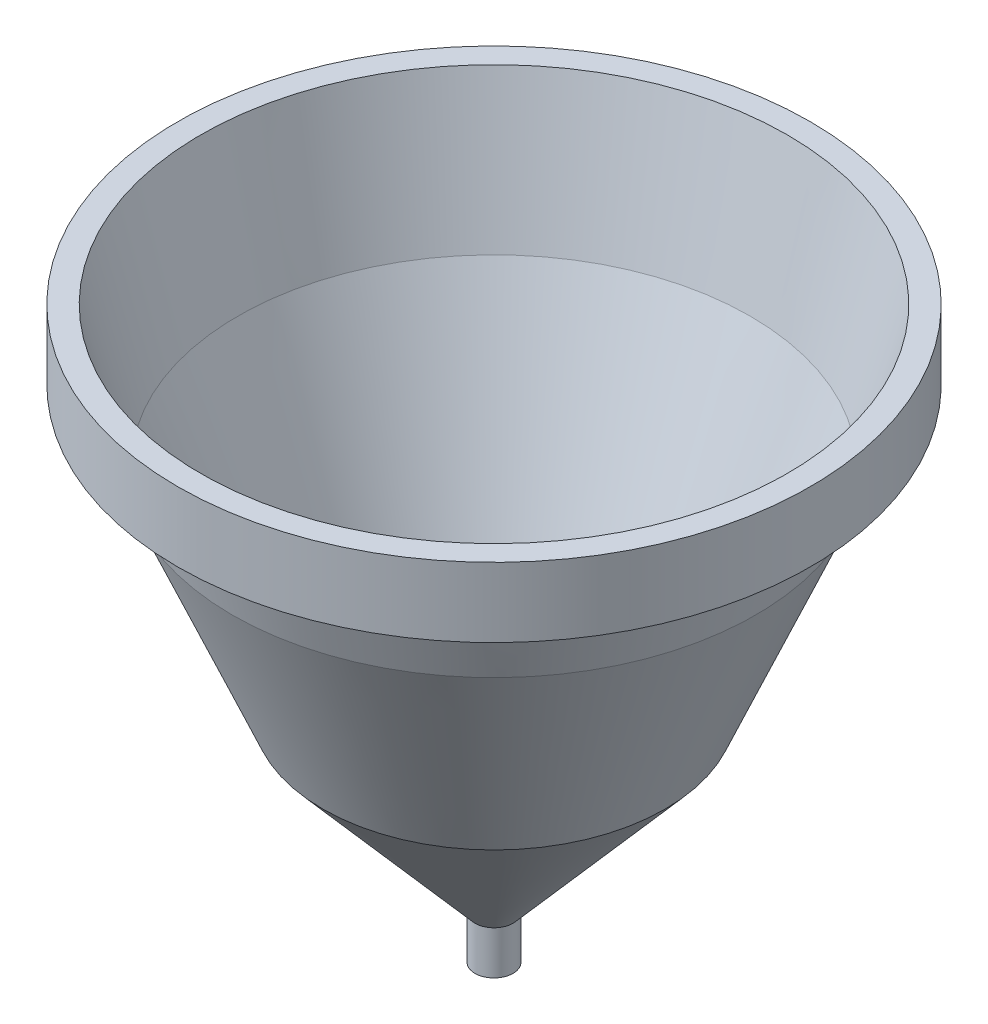
from build123d import *


with BuildPart() as part:
    # Schizzo1 → Rivoluzione1 (revolve)
    with BuildSketch(Plane(origin=(0, 0, 0), x_dir=(0, 0, -1), z_dir=(1, 0, 0)), mode=Mode.PRIVATE) as rivoluzione1_sk:
        Polygon((24.193102917, 11.737734445), (24.193102917, -3.262265555), (25.77022715, -3.392816036), (25.77022715, 12.407183964), (-26.71449517, 72.783950382), (-28.291619402, 72.114500863), align=None)
        Polygon((-59.550109681, 145.754889139), (-28.291619402, 72.114500863), (-26.71449517, 72.783950382), (-57.688820987, 145.754889139), (-66.872170267, 180.027615233), (-70.49877626, 193.562293059), (-78.40877626, 193.562293059), (-78.40877626, 169.562293059), (-76.60877626, 169.562293059), (-76.60877626, 179.562293059), (-68.60877626, 179.562293059), align=None)
    revolve(rivoluzione1_sk.sketch.rotate(Axis((0, -3.392816036, -30.77022715), (0, 1, 0)), 180), axis=Axis((0, -3.392816036, -30.77022715), (0, 1, 0)))


solid = part.part
